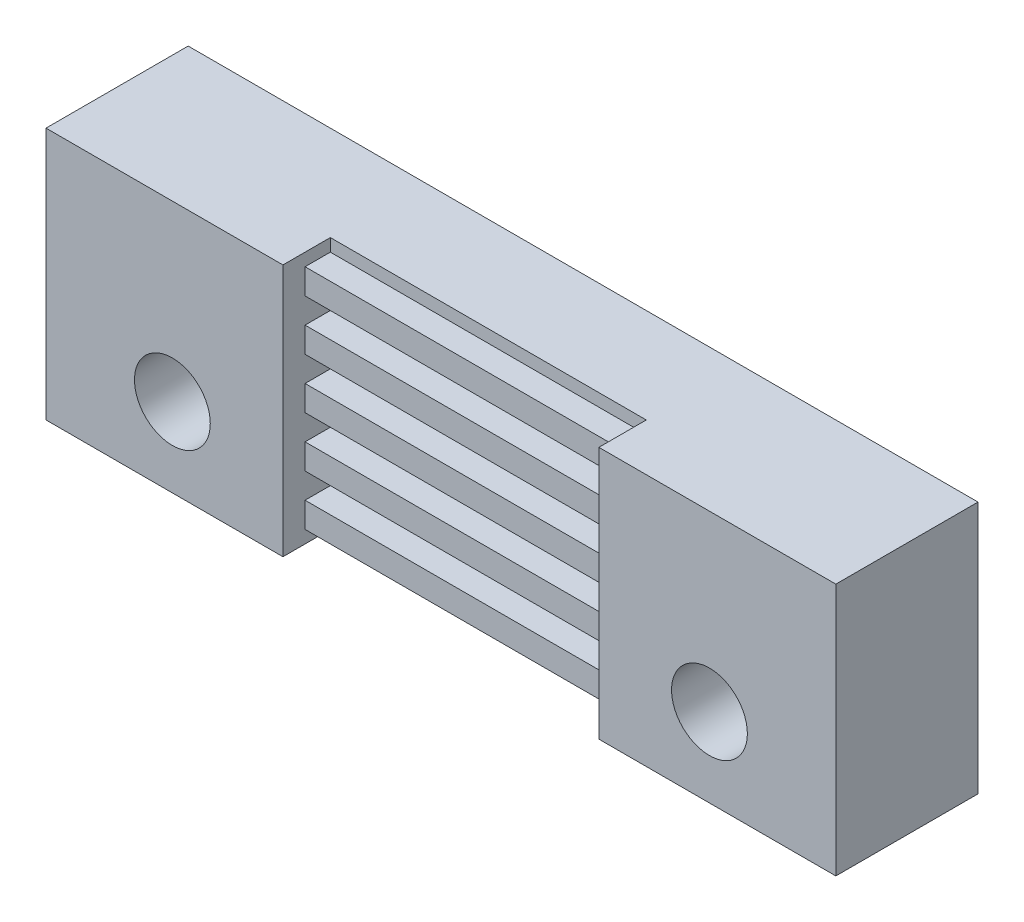
from build123d import *

# Parameters (mm, degrees)
SKETCH_1_W          = 25
SKETCH_1_H          = 8
SKETCH_1_R          = 1.2
EXTRUDE_2_DEPTH     = 4
SKETCH_2_W          = 10
SKETCH_2_H          = 0.8
EXTRUDE_3_DEPTH     = 0.8
SKETCH_3_W          = 7.5
SKETCH_3_H          = 8
SKETCH_3_R          = 1.2
EXTRUDE_4_DEPTH     = 1.5
SKETCH_4_W          = 25
SKETCH_4_H          = 1
CUT_EXTRUDE_1_DEPTH = 19.5


with BuildPart() as part:
    # 草图1 → 凸台-拉伸2 (new body)
    with BuildSketch(Plane.XY):
        with Locations((0.109785312, -0.548926558)):
            Rectangle(SKETCH_1_W, SKETCH_1_H)
        with Locations((-8.390214688, -2.048926558)):
            Circle(SKETCH_1_R, mode=Mode.SUBTRACT)
        with Locations((8.609785312, -2.048926558)):
            Circle(SKETCH_1_R, mode=Mode.SUBTRACT)
    extrude(amount=EXTRUDE_2_DEPTH)

    # 草图2 → 凸台-拉伸3 (add)
    with BuildSketch(Plane.XY.offset(4)):
        with Locations((0.109785312, -3.748926558)):
            Rectangle(SKETCH_2_W, SKETCH_2_H)
        with Locations((0.109785312, -2.148926558)):
            Rectangle(SKETCH_2_W, SKETCH_2_H)
        with Locations((0.109785312, -0.548926558)):
            Rectangle(SKETCH_2_W, SKETCH_2_H)
        with Locations((0.109785312, 2.651073442)):
            Rectangle(SKETCH_2_W, SKETCH_2_H)
        with Locations((0.109785312, 1.051073442)):
            Rectangle(SKETCH_2_W, SKETCH_2_H)
    extrude(amount=EXTRUDE_3_DEPTH)

    # 草图3 → 凸台-拉伸4 (add)
    # profile 1 of 2: a face of its own
    with BuildSketch(Plane.XY.offset(4)):
        with Locations((-8.640214688, -0.548926558)):
            Rectangle(SKETCH_3_W, SKETCH_3_H)
        with Locations((-8.390214688, -2.048926558)):
            Circle(SKETCH_3_R, mode=Mode.SUBTRACT)
    # profile 2 of 2: a face of its own
    with BuildSketch(Plane.XY.offset(4)):
        with Locations((8.859785312, -0.548926558)):
            Rectangle(SKETCH_3_W, SKETCH_3_H)
        with Locations((8.609785312, -2.048926558)):
            Circle(SKETCH_3_R, mode=Mode.SUBTRACT)
    extrude(amount=EXTRUDE_4_DEPTH)

    # 草图4 → 切除-拉伸1 (cut)
    with BuildSketch(Plane(origin=(0, 3.451073442, 0), x_dir=(1, 0, 0), z_dir=(0, 1, 0))):
        with Locations((0.109785312, -0.5)):
            Rectangle(SKETCH_4_W, SKETCH_4_H)
    extrude(amount=-CUT_EXTRUDE_1_DEPTH, mode=Mode.SUBTRACT)


solid = part.part
